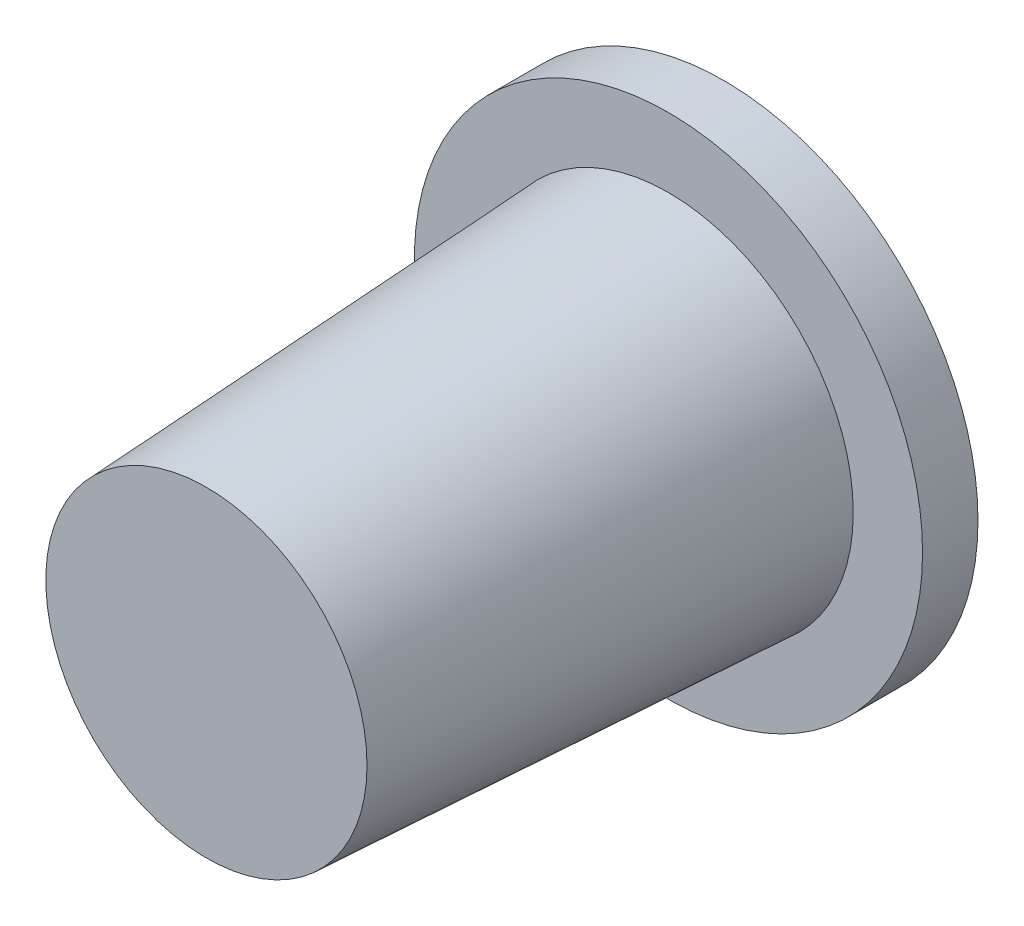
from build123d import *

# Parameters (mm, degrees)
SKETCH_1_R      = 2.75
EXTRUDE_1_DEPTH = 0.6
SKETCH_2_R      = 2
EXTRUDE_2_DEPTH = 5
EXTRUDE_2_TAPER = 3


with BuildPart() as part:
    # 草图1 → 凸台-拉伸1 (new body)
    with BuildSketch(Plane.XY):
        Circle(SKETCH_1_R)
    extrude(amount=EXTRUDE_1_DEPTH)

    # 草图2 → 凸台-拉伸2 (add)
    with BuildSketch(Plane.XY.offset(0.6)):
        Circle(SKETCH_2_R)
    extrude(amount=EXTRUDE_2_DEPTH, taper=EXTRUDE_2_TAPER)


solid = part.part
